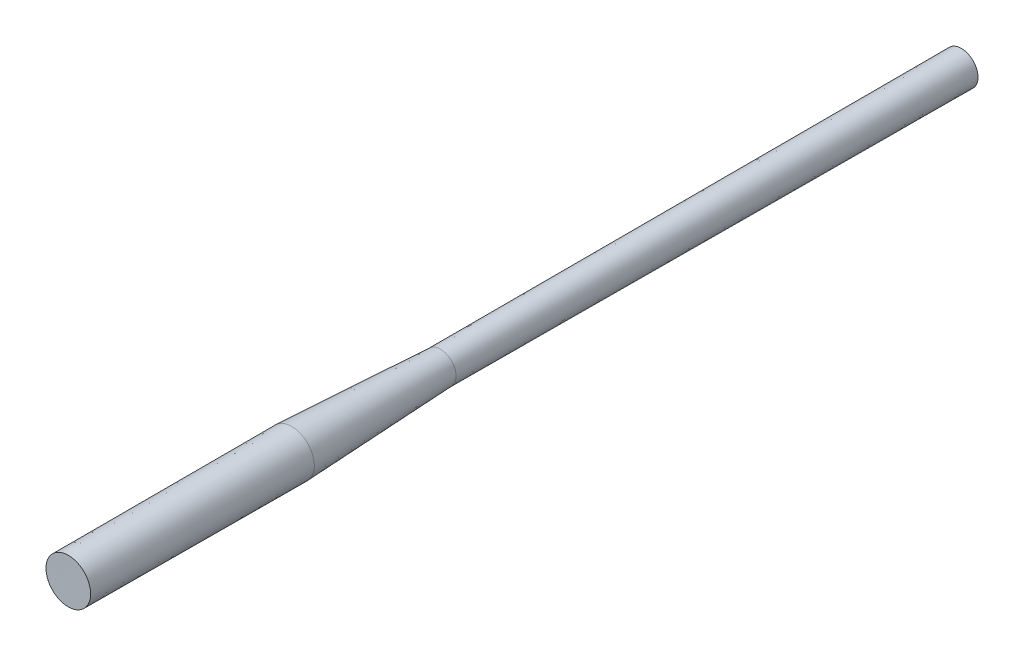
from build123d import *


with BuildPart() as part:
    # Sketch2 → Revolve1 (revolve)
    with BuildSketch(Plane(origin=(0, 0, 0), x_dir=(0, 0, -1), z_dir=(1, 0, 0)), mode=Mode.PRIVATE) as revolve1_sk:
        Polygon((0, 76.2), (762, 76.2), (1270, 50.8), (3048, 50.8), (3048, -6.283425374), (0, 0), align=None)
    revolve(revolve1_sk.sketch.rotate(Axis((0, 0, 0), (0, -0.0020614868841661526, -0.9999978751336558)), 180), axis=Axis((0, 0, 0), (0, -0.0020614868841661526, -0.9999978751336558)))


solid = part.part
